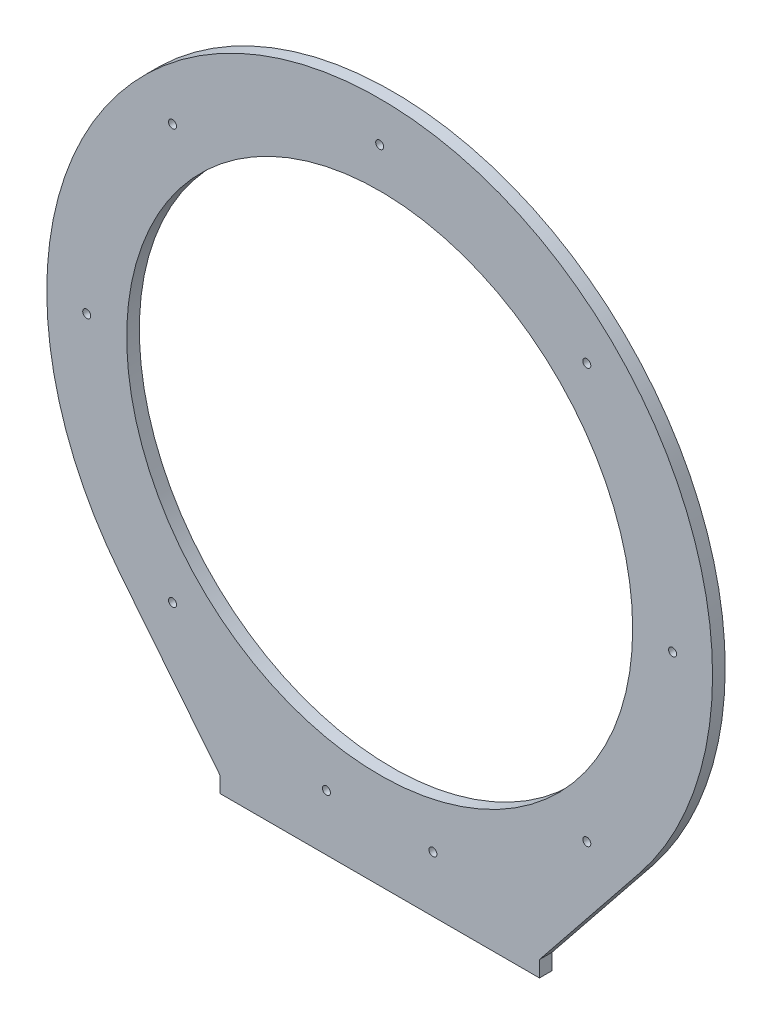
from build123d import *

# Parameters (mm, degrees)
SKETCH1_R           = 1.5
SKETCH1_R_2         = 95
BOSS_EXTRUDE1_DEPTH = 4.75


with BuildPart() as part:
    # Sketch1 → Boss-Extrude1 (new body)
    with BuildSketch(Plane.XY):
        with BuildLine():
            Line((-97.529258778, -78.185955787), (-60, -125))
            Line((-60, -125), (-60, -131))
            Line((-60, -131), (60, -131))
            Line((60, -131), (60, -125))
            Line((60, -125), (97.529258778, -78.185955787))
            ThreePointArc((97.529258778, -78.185955787), (0, 125), (-97.529258778, -78.185955787))
        make_face()
        with Locations((-77.781745931, -77.781745931)):
            Circle(SKETCH1_R, mode=Mode.SUBTRACT)
        with Locations((-20, -110)):
            Circle(SKETCH1_R, mode=Mode.SUBTRACT)
        with Locations((20, -110)):
            Circle(SKETCH1_R, mode=Mode.SUBTRACT)
        with Locations((77.781745931, -77.781745931)):
            Circle(SKETCH1_R, mode=Mode.SUBTRACT)
        with Locations((-110, 0)):
            Circle(SKETCH1_R, mode=Mode.SUBTRACT)
        with Locations((-77.781745931, 77.781745931)):
            Circle(SKETCH1_R, mode=Mode.SUBTRACT)
        Circle(SKETCH1_R_2, mode=Mode.SUBTRACT)
        with Locations((110, 0)):
            Circle(SKETCH1_R, mode=Mode.SUBTRACT)
        with Locations((0, 110)):
            Circle(SKETCH1_R, mode=Mode.SUBTRACT)
        with Locations((77.781745931, 77.781745931)):
            Circle(SKETCH1_R, mode=Mode.SUBTRACT)
    extrude(amount=BOSS_EXTRUDE1_DEPTH)


solid = part.part
